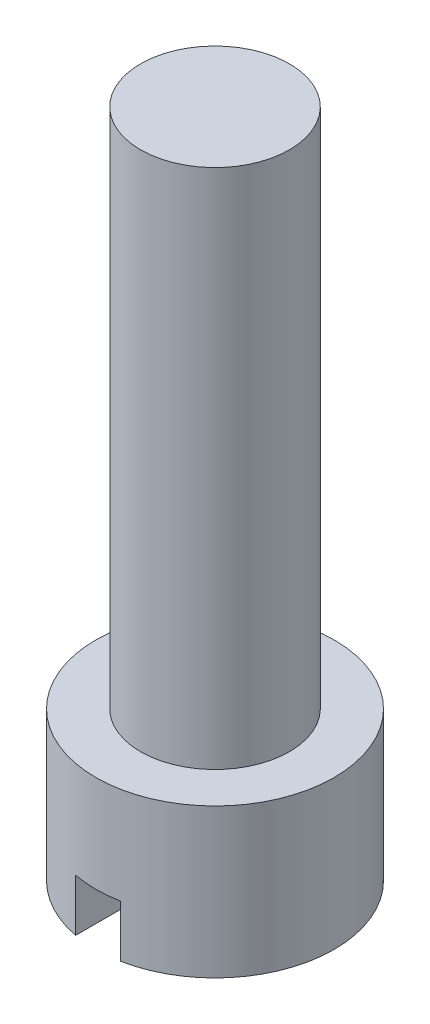
from build123d import *

# Parameters (mm, degrees)
SKETCH_1_R          = 8
EXTRUDE_1_DEPTH     = 10
SKETCH_2_W          = 3
SKETCH_2_H          = 3.5
CUT_EXTRUDE_1_DEPTH = 11.95
SKETCH_3_R          = 5
EXTRUDE_2_DEPTH     = 35


with BuildPart() as part:
    # Эскиз1 → Бобышка-Вытянуть1 (new body)
    with BuildSketch(Plane(origin=(0, 0, 0), x_dir=(1, 0, 0), z_dir=(0, 1, 0))):
        with Locations(Location((0, 0, 0), (0, 0, 270))):
            Circle(SKETCH_1_R)
    extrude(amount=EXTRUDE_1_DEPTH)

    # Эскиз2 → Вырез-Вытянуть1 (cut, symmetric)
    with BuildSketch(Plane.XY):
        with Locations((0, 1.75)):
            Rectangle(SKETCH_2_W, SKETCH_2_H)
    extrude(amount=CUT_EXTRUDE_1_DEPTH, both=True, mode=Mode.SUBTRACT)

    # Эскиз3 → Бобышка-Вытянуть2 (add)
    with BuildSketch(Plane(origin=(0, 10, 0), x_dir=(1, 0, 0), z_dir=(0, 1, 0))):
        with Locations(Location((0, 0, 0), (0, 0, 270))):
            Circle(SKETCH_3_R)
    extrude(amount=EXTRUDE_2_DEPTH)


solid = part.part
